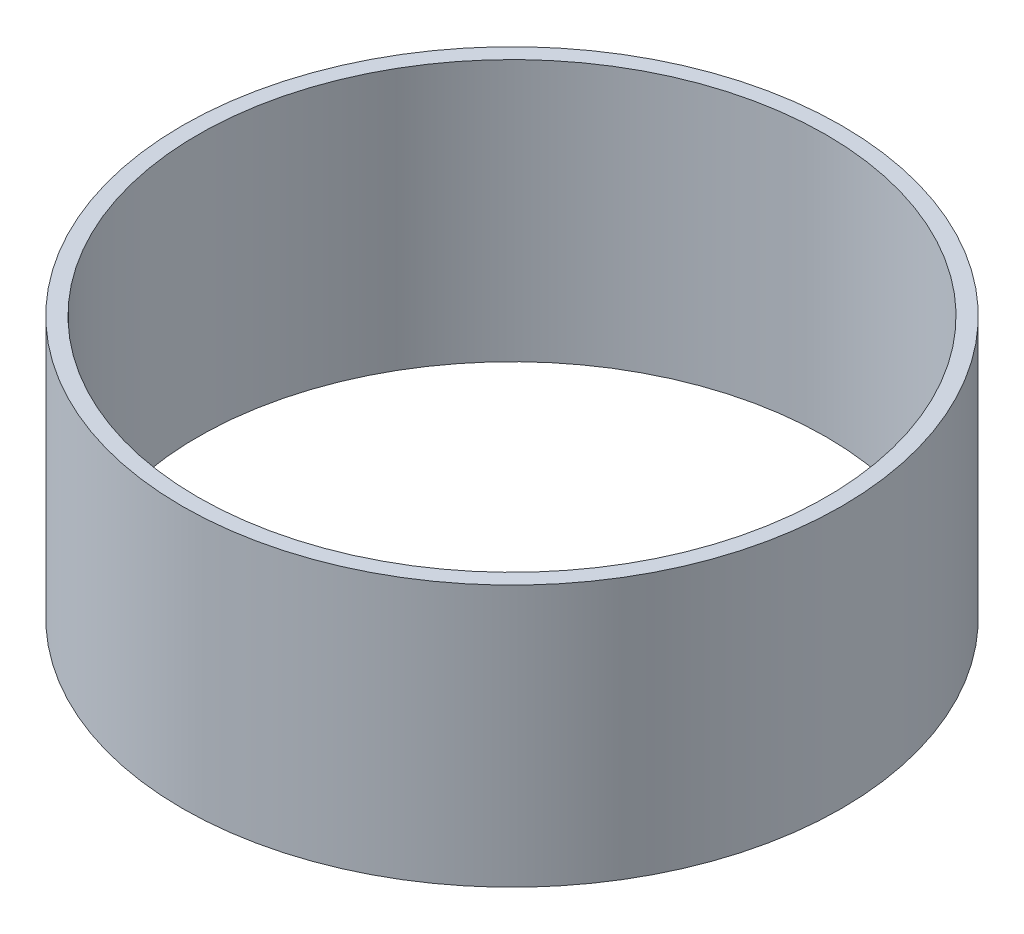
from build123d import *

# Parameters (mm, degrees)
SKETCH_1_R      = 6.3
SKETCH_1_R_2    = 6
EXTRUDE_1_DEPTH = 5


with BuildPart() as part:
    # Эскиз1 → Бобышка-Вытянуть1 (new body)
    with BuildSketch(Plane(origin=(0, 0, 0), x_dir=(1, 0, 0), z_dir=(0, 1, 0))):
        with Locations(Location((0, 0, 0), (0, 0, 270))):
            Circle(SKETCH_1_R)
        with Locations(Location((0, 0, 0), (0, 0, 270))):
            Circle(SKETCH_1_R_2, mode=Mode.SUBTRACT)
    extrude(amount=EXTRUDE_1_DEPTH)


solid = part.part
